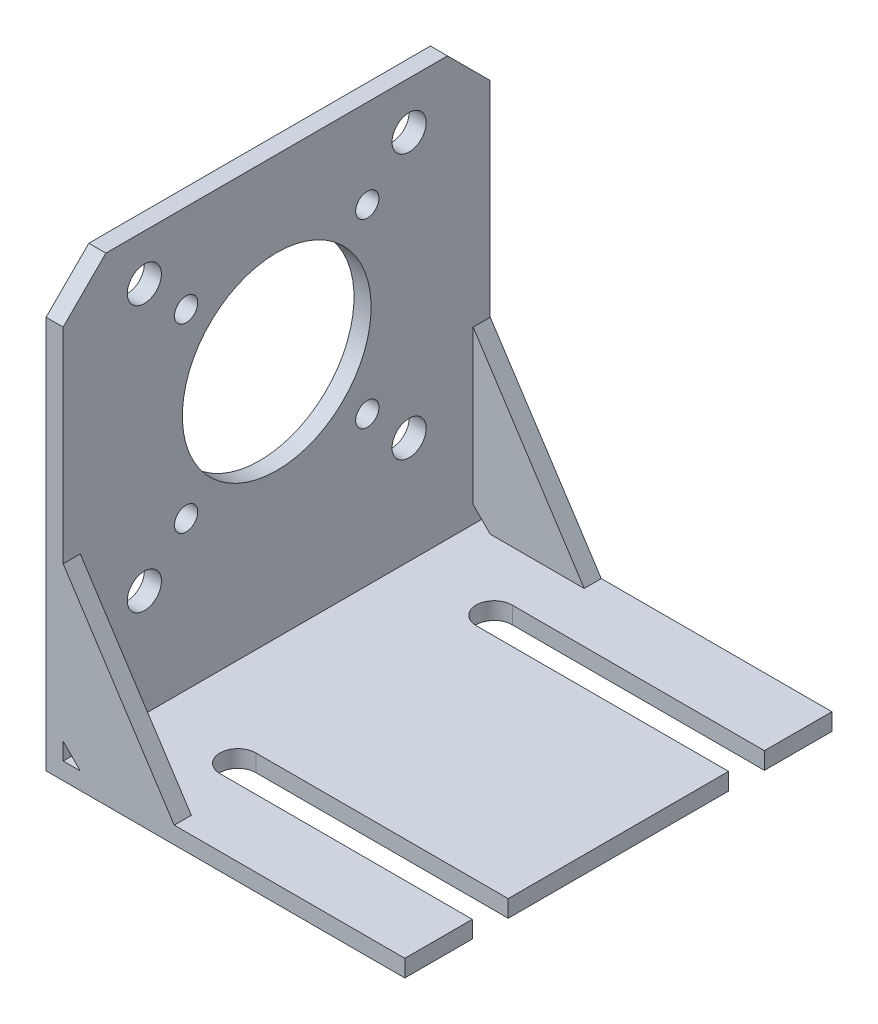
from build123d import *

# Parameters (mm, degrees)
BOSS_EXTRUDE1_DEPTH = 50
SKETCH2_R           = 11.05
SKETCH2_R_2         = 2
CUT_EXTRUDE1_DEPTH  = 88.761039192
CUT_EXTRUDE2_DEPTH  = 50
BOSS_EXTRUDE2_DEPTH = 2
BOSS_EXTRUDE3_DEPTH = 2
CHAMFER1_SIZE       = 5
SKETCH8_R           = 1.3611534
CUT_EXTRUDE3_DEPTH  = 10
SKETCH9_W           = 26.186270306
SKETCH9_H           = 50
CUT_EXTRUDE4_DEPTH  = 10


with BuildPart() as part:
    # Sketch1 → Boss-Extrude1 (new body)
    with BuildSketch(Plane.XY):
        Polygon((0, 0), (0, 51), (2, 51), (2, 2), (53, 2), (53, 0), align=None)
    extrude(amount=BOSS_EXTRUDE1_DEPTH)

    # Sketch2 → Cut-Extrude1 (cut, through all)
    with BuildSketch(Plane(origin=(2, 0, 0), x_dir=(0, 0, -1), z_dir=(1, 0, 0))):
        with Locations(Location((-25, 30, 0), (0, 0, 90))):
            Circle(SKETCH2_R)
        with Locations(Location((-40.5, 45.640445987, 0), (0, 0, 90))):
            Circle(SKETCH2_R_2)
        with Locations(Location((-9.5, 45.5, 0), (0, 0, 90))):
            Circle(SKETCH2_R_2)
        with Locations(Location((-40.5, 14.5, 0), (0, 0, 90))):
            Circle(SKETCH2_R_2)
        with Locations(Location((-9.5, 14.5, 0), (0, 0, 90))):
            Circle(SKETCH2_R_2)
    extrude(amount=-CUT_EXTRUDE1_DEPTH, mode=Mode.SUBTRACT)

    # Sketch3 → Cut-Extrude2 (cut)
    with BuildSketch(Plane(origin=(0, 2, 0), x_dir=(1, 0, 0), z_dir=(0, 1, 0))):
        with BuildLine():
            Line((12.455251015, -12.1), (42.544748985, -12.1))
            ThreePointArc((42.544748985, -12.1), (44.644629774, -9.977624237), (42.5, -7.900476833))
            Line((42.5, -7.900476833), (12.5, -7.900476833))
            ThreePointArc((12.5, -7.900476833), (10.355370226, -9.977624237), (12.455251015, -12.1))
        make_face()
        with BuildLine():
            Line((12.5, -42.099523167), (42.5, -42.099523167))
            ThreePointArc((42.5, -42.099523167), (44.644629774, -40.022375763), (42.544748985, -37.9))
            Line((42.544748985, -37.9), (12.455251015, -37.9))
            ThreePointArc((12.455251015, -37.9), (10.355370226, -40.022375763), (12.5, -42.099523167))
        make_face()
    extrude(amount=-CUT_EXTRUDE2_DEPTH, mode=Mode.SUBTRACT)

    # Sketch5 → Boss-Extrude2 (add)
    with BuildSketch(Plane.XY.offset(50)):
        Polygon((2, 22), (2, 4), (4, 2), (15, 2), align=None)
    extrude(amount=-BOSS_EXTRUDE2_DEPTH)

    # Sketch6 → Boss-Extrude3 (add)
    with BuildSketch(Plane(origin=(0, 0, 0), x_dir=(-1, 0, 0), z_dir=(0, 0, -1))):
        Polygon((-4, 2), (-2, 4), (-2, 22), (-15, 2), align=None)
    extrude(amount=-BOSS_EXTRUDE3_DEPTH)

    # Chamfer1
    chamfer1_edges = [part.edges().sort_by_distance(p)[0] for p in [
        (1, 51, 50),
        (1, 51, 0),
        (53, 1, 50),
        (53, 1, 0),
    ]]
    chamfer(chamfer1_edges, length=CHAMFER1_SIZE)

    # Sketch8 → Cut-Extrude3 (cut)
    with BuildSketch(Plane.ZY):
        with Locations(Location((35.606601718, 19.393398282, 0), (0, 0, 270))):
            Circle(SKETCH8_R)
        with Locations(Location((14.393398282, 19.393398282, 0), (0, 0, 270))):
            Circle(SKETCH8_R)
        with Locations(Location((14.393398282, 40.606601718, 0), (0, 0, 270))):
            Circle(SKETCH8_R)
        with Locations(Location((35.606601718, 40.606601718, 0), (0, 0, 270))):
            Circle(SKETCH8_R)
    extrude(amount=-CUT_EXTRUDE3_DEPTH, mode=Mode.SUBTRACT)

    # Sketch9 → Cut-Extrude4 (cut)
    with BuildSketch(Plane(origin=(0, 2, 0), x_dir=(1, 0, 0), z_dir=(0, 1, 0))):
        with Locations((55.093135153, -25)):
            Rectangle(SKETCH9_W, SKETCH9_H)
    extrude(amount=-CUT_EXTRUDE4_DEPTH, mode=Mode.SUBTRACT)


solid = part.part
